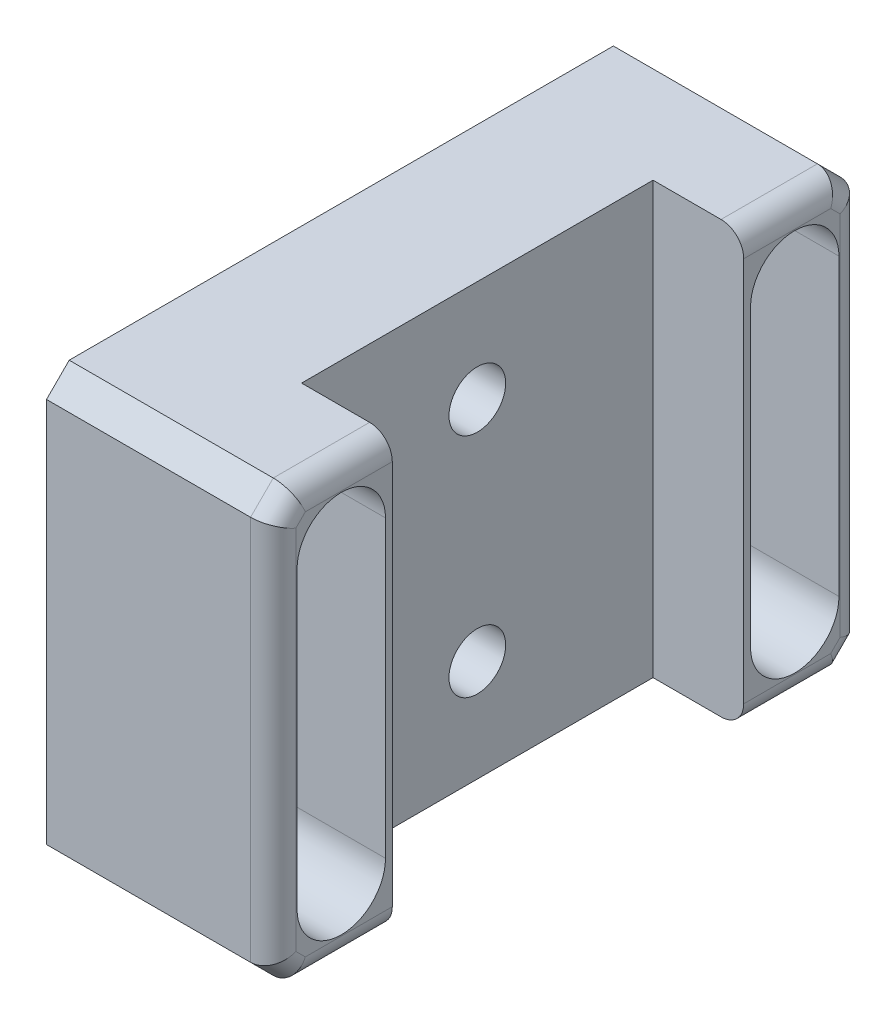
from build123d import *

# Parameters (mm, degrees)
SKETCH_1_W          = 26
SKETCH_1_H          = 19
EXTRUDE_1_DEPTH     = 10
SKETCH_2_W          = 15.5
SKETCH_2_H          = 19
CUT_EXTRUDE_1_DEPTH = 4
CUT_EXTRUDE_2_DEPTH = 4
CHAMFER_1_SIZE      = 1
FILLET_1_R          = 1
SKETCH_4_R          = 1.25
CUT_EXTRUDE_3_DEPTH = 18.182840277
CUT_EXTRUDE_4_DEPTH = 2


with BuildPart() as part:
    # Эскиз1 → Бобышка-Вытянуть1 (new body)
    with BuildSketch(Plane(origin=(0, 0, 0), x_dir=(0, 0, -1), z_dir=(1, 0, 0))):
        Rectangle(SKETCH_1_W, SKETCH_1_H)
        with BuildLine():
            Line((-8.75, 6.5), (-8.75, -6.5))
            ThreePointArc((-8.75, -6.5), (-10, -7.75), (-11.25, -6.5))
            Line((-11.25, -6.5), (-11.25, 6.5))
            ThreePointArc((-11.25, 6.5), (-10, 7.75), (-8.75, 6.5))
        make_face(mode=Mode.SUBTRACT)
        with BuildLine():
            Line((8.75, 6.5), (8.75, -6.5))
            ThreePointArc((8.75, -6.5), (10, -7.75), (11.25, -6.5))
            Line((11.25, -6.5), (11.25, 6.5))
            ThreePointArc((11.25, 6.5), (10, 7.75), (8.75, 6.5))
        make_face(mode=Mode.SUBTRACT)
    extrude(amount=EXTRUDE_1_DEPTH)

    # Эскиз2 → Вырез-Вытянуть1 (cut)
    with BuildSketch(Plane(origin=(10, 0, 0), x_dir=(0, 0, -1), z_dir=(1, 0, 0))):
        Rectangle(SKETCH_2_W, SKETCH_2_H)
    extrude(amount=-CUT_EXTRUDE_1_DEPTH, mode=Mode.SUBTRACT)

    # Эскиз3 → Вырез-Вытянуть2 (cut)
    with BuildSketch(Plane(origin=(10, 0, 0), x_dir=(0, 0, -1), z_dir=(1, 0, 0))):
        with BuildLine():
            Line((-11.95, -6.5), (-11.95, 6.5))
            ThreePointArc((-11.95, 6.5), (-10, 8.45), (-8.05, 6.5))
            Line((-8.05, 6.5), (-8.05, -6.5))
            ThreePointArc((-8.05, -6.5), (-10, -8.45), (-11.95, -6.5))
        make_face()
        with BuildLine():
            Line((11.95, -6.5), (11.95, 6.5))
            ThreePointArc((11.95, 6.5), (10, 8.45), (8.05, 6.5))
            Line((8.05, 6.5), (8.05, -6.5))
            ThreePointArc((8.05, -6.5), (10, -8.45), (11.95, -6.5))
        make_face()
    extrude(amount=-CUT_EXTRUDE_2_DEPTH, mode=Mode.SUBTRACT)

    # Фаска1
    chamfer_1_edges = [part.edges().sort_by_distance(p)[0] for p in [
        (5, -9.5, -13),
        (5, -9.5, 13),
        (5, 9.5, 13),
        (5, 9.5, -13),
    ]]
    chamfer(chamfer_1_edges, length=CHAMFER_1_SIZE)

    # Скругление1
    fillet_1_edges = [part.edges().sort_by_distance(p)[0] for p in [
        (10, 9.5, -9.875),
        (10, 0, -13),
        (10, -9, -12.5),
        (10, 9, -12.5),
        (10, -9.5, 9.875),
        (10, 0, 13),
        (10, 9, 12.5),
        (10, -9, 12.5),
        (10, -9.5, -9.875),
        (10, 9.5, 9.875),
    ]]
    fillet(fillet_1_edges, radius=FILLET_1_R)

    # Эскиз4 → Вырез-Вытянуть3 (cut, through all)
    with BuildSketch(Plane(origin=(6, 0, 0), x_dir=(0, 0, -1), z_dir=(1, 0, 0))):
        with Locations((0, 5)):
            Circle(SKETCH_4_R)
        with Locations(Location((0, -5, 0), (0, 0, 180))):
            Circle(SKETCH_4_R)
    extrude(amount=-CUT_EXTRUDE_3_DEPTH, mode=Mode.SUBTRACT)

    # Эскиз5 → Вырез-Вытянуть4 (cut)
    with BuildSketch(Plane.ZY):
        Polygon((1.169134295, 2.975), (2.33826859, 5), (1.169134295, 7.025), (-1.169134295, 7.025), (-2.33826859, 5), (-1.169134295, 2.975), align=None)
        Polygon((1.169134295, -7.025), (2.33826859, -5), (1.169134295, -2.975), (-1.169134295, -2.975), (-2.33826859, -5), (-1.169134295, -7.025), align=None)
    extrude(amount=-CUT_EXTRUDE_4_DEPTH, mode=Mode.SUBTRACT)


solid = part.part
